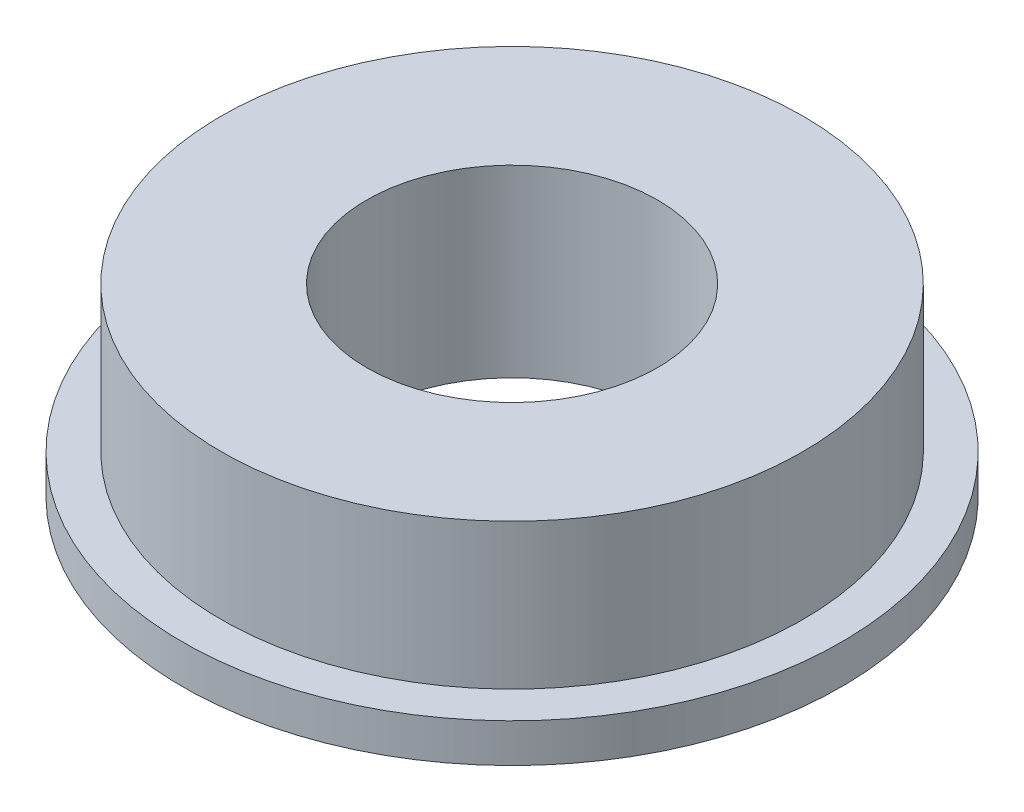
from build123d import *


with BuildPart() as part:
    # 草图1 → 旋转1 (revolve)
    with BuildSketch(Plane.XY, mode=Mode.PRIVATE) as revolve_1_sk:
        Polygon((-3, 3.8), (-3, 0), (-6.8, 0), (-6.8, 0.8), (-6, 0.8), (-6, 3.8), align=None)
    revolve(revolve_1_sk.sketch.rotate(Axis((0, 0, 0), (0, 1, 0)), 270), axis=Axis((0, 0, 0), (0, 1, 0)))


solid = part.part
